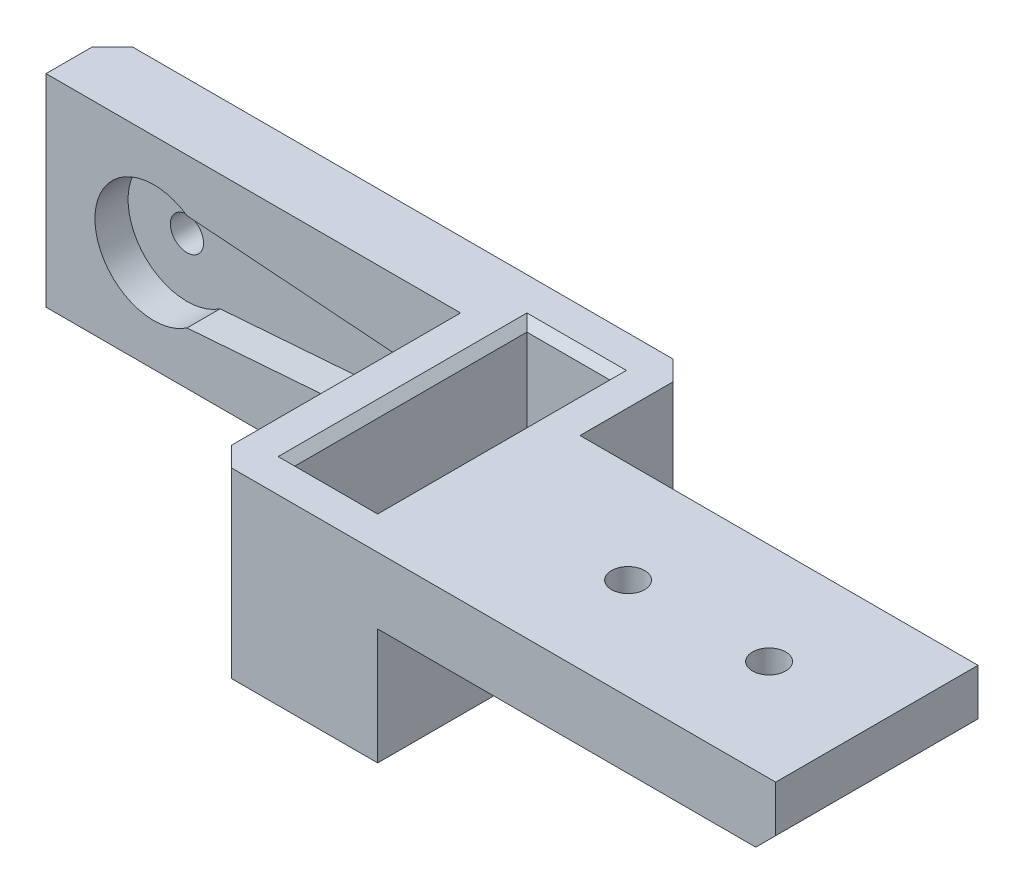
from build123d import *

# Parameters (mm, degrees)
SKETCH1_W               = 35
SKETCH1_H               = 12.2
BOSS_EXTRUDE1_DEPTH     = 4
SKETCH2_R               = 1
CUT_EXTRUDE1_DEPTH      = 38.656658625
SKETCH3_W               = 10
SKETCH3_H               = 12.2
BOSS_EXTRUDE2_DEPTH     = 15
SKETCH4_W               = 12.2
SKETCH4_H               = 4
BOSS_EXTRUDE3_DEPTH     = 24
CUT_EXTRUDE2_DEPTH      = 42.133377247
CUT_EXTRUDE2_DEPTH_BACK = 42.133377247
SKETCH5_R               = 1
CUT_EXTRUDE3_DEPTH      = 0.5
CHAMFER1_SIZE           = 1.2
CUT_EXTRUDE17_DEPTH     = 2
CUT_EXTRUDE18_DEPTH     = 2
SKETCH26_W              = 5
SKETCH26_H              = 14
CUT_EXTRUDE19_DEPTH     = 43.113593099
CHAMFER2_SIZE           = 0.5


with BuildPart() as part:
    # Sketch1 → Boss-Extrude1 (new body)
    with BuildSketch(Plane.XY):
        with Locations((-18.048765432, 5.660493827)):
            Rectangle(SKETCH1_W, SKETCH1_H)
    extrude(amount=BOSS_EXTRUDE1_DEPTH)

    # Sketch2 → Cut-Extrude1 (cut, through all)
    with BuildSketch(Plane.XY.offset(4)):
        with Locations((-29.048765432, 5.660493827)):
            Circle(SKETCH2_R)
    extrude(amount=-CUT_EXTRUDE1_DEPTH, mode=Mode.SUBTRACT)

    # Sketch3 → Boss-Extrude2 (add)
    with BuildSketch(Plane.XY.offset(4)):
        with Locations((-5.548765432, 5.660493827)):
            Rectangle(SKETCH3_W, SKETCH3_H)
    extrude(amount=BOSS_EXTRUDE2_DEPTH)

    # Sketch4 → Boss-Extrude3 (add)
    with BuildSketch(Plane(origin=(-0.548765432, 0, 0), x_dir=(0, 0, -1), z_dir=(1, 0, 0))):
        with Locations((-12.9, 9.760493827)):
            Rectangle(SKETCH4_W, SKETCH4_H)
    extrude(amount=BOSS_EXTRUDE3_DEPTH)

    # Sketch5 → Cut-Extrude2 (cut, two sides: drawn at the far end of the back side and taken through both)
    with BuildSketch(Plane.XZ.offset(-7.760493827).offset(-CUT_EXTRUDE2_DEPTH_BACK)):
        with Locations(Location((16.951234568, 12.9, 0), (0, 0, 270))):
            Circle(SKETCH5_R)
        with Locations(Location((8.451234568, 12.9, 0), (0, 0, 270))):
            Circle(SKETCH5_R)
    extrude(amount=CUT_EXTRUDE2_DEPTH + CUT_EXTRUDE2_DEPTH_BACK, mode=Mode.SUBTRACT)

    # Sketch7 → Cut-Extrude3 (cut)
    with BuildSketch(Plane(origin=(0, 0, 0), x_dir=(-1, 0, 0), z_dir=(0, 0, -1))):
        Polygon((23.048765432, 5.660493827), (19.298765432, 7.825557337), (19.298765432, 3.495430318), align=None)
    extrude(amount=-CUT_EXTRUDE3_DEPTH, mode=Mode.SUBTRACT)

    # Chamfer1
    chamfer1_edges = [part.edges().sort_by_distance(p)[0] for p in [
        (-10.548765432, -0.439506173, 11.5),
        (-10.548765432, 5.660493827, 19),
        (-5.548765432, -0.439506173, 19),
        (23.451234568, 7.760493827, 12.9),
        (-0.548765432, 5.660493827, 0),
        (-18.048765432, -0.439506173, 0),
        (-35.548765432, 5.660493827, 0),
        (-0.548765432, -0.439506173, 9.5),
    ]]
    chamfer(chamfer1_edges, length=CHAMFER1_SIZE)

    # Sketch24 → Cut-Extrude17 (cut)
    with BuildSketch(Plane.XY.offset(4)):
        with BuildLine():
            Line((-27.048765432, 2.727491952), (-14.648765432, 3.660493827))
            ThreePointArc((-14.648765432, 3.660493827), (-12.648765432, 5.660493827), (-14.648765432, 7.660493827))
            Line((-14.648765432, 7.660493827), (-27.048765432, 8.593495702))
            ThreePointArc((-27.048765432, 8.593495702), (-32.598765432, 5.660493827), (-27.048765432, 2.727491952))
        make_face()
    extrude(amount=-CUT_EXTRUDE17_DEPTH, mode=Mode.SUBTRACT)

    # Sketch25 → Cut-Extrude18 (cut)
    with BuildSketch(Plane.XZ.offset(-7.760493827)):
        with BuildLine():
            Line((2.551234568, 14.9), (14.951234568, 15.833001875))
            ThreePointArc((14.951234568, 15.833001875), (20.501234568, 12.9), (14.951234568, 9.966998125))
            Line((14.951234568, 9.966998125), (2.551234568, 10.9))
            ThreePointArc((2.551234568, 10.9), (0.551234568, 12.9), (2.551234568, 14.9))
        make_face()
    extrude(amount=-CUT_EXTRUDE18_DEPTH, mode=Mode.SUBTRACT)

    # Sketch26 → Cut-Extrude19 (cut, through all)
    with BuildSketch(Plane(origin=(0, 11.760493827, 0), x_dir=(1, 0, 0), z_dir=(0, 1, 0))):
        with Locations((-5.548765432, -9.5)):
            Rectangle(SKETCH26_W, SKETCH26_H)
    extrude(amount=-CUT_EXTRUDE19_DEPTH, mode=Mode.SUBTRACT)

    # Chamfer2
    chamfer2_edges = [part.edges().sort_by_distance(p)[0] for p in [
        (-8.048765432, -0.439506173, 9.5),
        (-5.548765432, -0.439506173, 2.5),
        (-3.048765432, -0.439506173, 9.5),
        (-5.548765432, -0.439506173, 16.5),
        (-8.048765432, 11.760493827, 9.5),
        (-5.548765432, 11.760493827, 16.5),
        (-3.048765432, 11.760493827, 9.5),
        (-5.548765432, 11.760493827, 2.5),
    ]]
    chamfer(chamfer2_edges, length=CHAMFER2_SIZE)


solid = part.part
